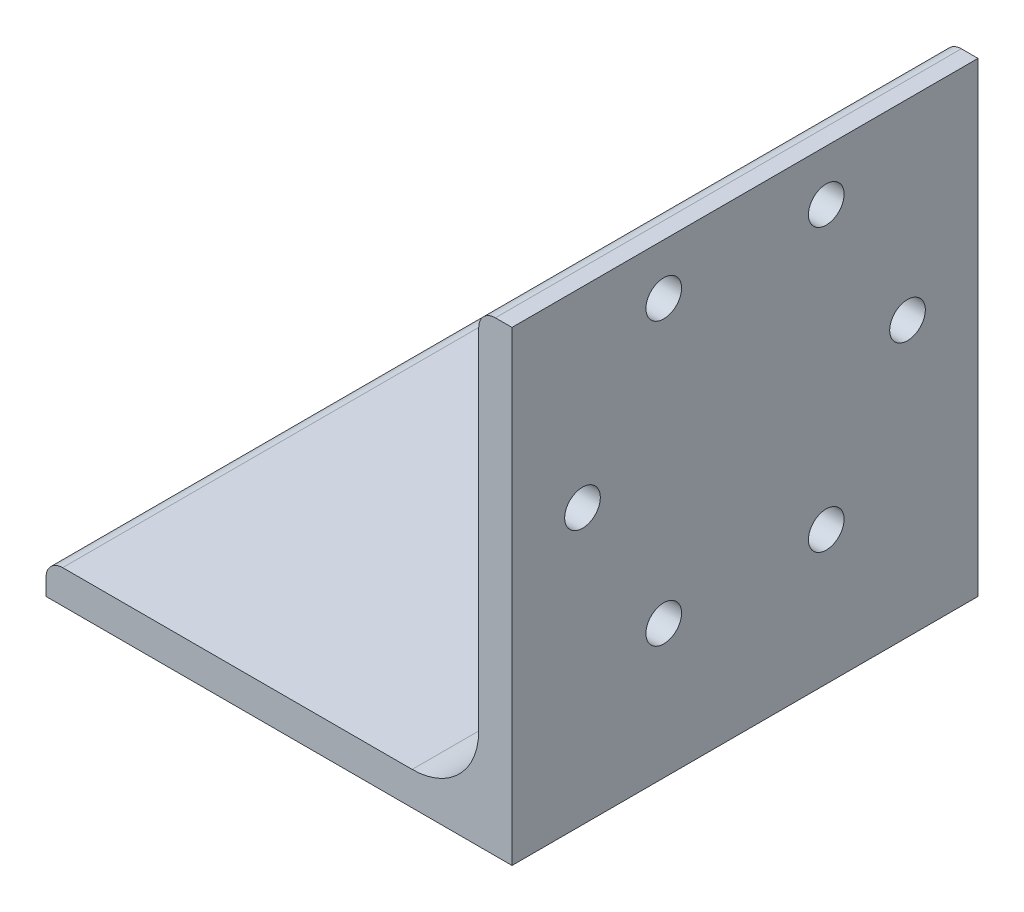
from build123d import *

# Parameters (mm, degrees)
BOSS_EXTRUDE1_DEPTH  = 22.225
M3_CLEARANCE_HOLE2_D = 3.4


with BuildPart() as part:
    # Sketch2 → Boss-Extrude1 (new, symmetric)
    with BuildSketch(Plane.XY):
        with BuildLine():
            Line((-22.225, 0), (22.225, 0))
            Line((22.225, 0), (22.225, 44.45))
            Line((22.225, 44.45), (20.6375, 44.45))
            ThreePointArc((20.6375, 44.45), (19.514967985, 43.985032015), (19.05, 42.8625))
            Line((19.05, 42.8625), (19.05, 9.525))
            ThreePointArc((19.05, 9.525), (17.190128061, 5.034871939), (12.7, 3.175))
            Line((12.7, 3.175), (-20.6375, 3.175))
            ThreePointArc((-20.6375, 3.175), (-21.760032015, 2.710032015), (-22.225, 1.5875))
            Line((-22.225, 1.5875), (-22.225, 0))
        make_face()
    extrude(amount=BOSS_EXTRUDE1_DEPTH, both=True)

    # M3 Clearance Hole2 (through all)
    with Locations(Plane.ZY.offset(-19.05)):
        with Locations((7.75, 12.770356241), (15.5, 26.19375), (7.75, 39.617143759), (-7.75, 39.617143759), (-15.5, 26.19375), (-7.75, 12.770356241)):
            Hole(M3_CLEARANCE_HOLE2_D / 2)


solid = part.part
